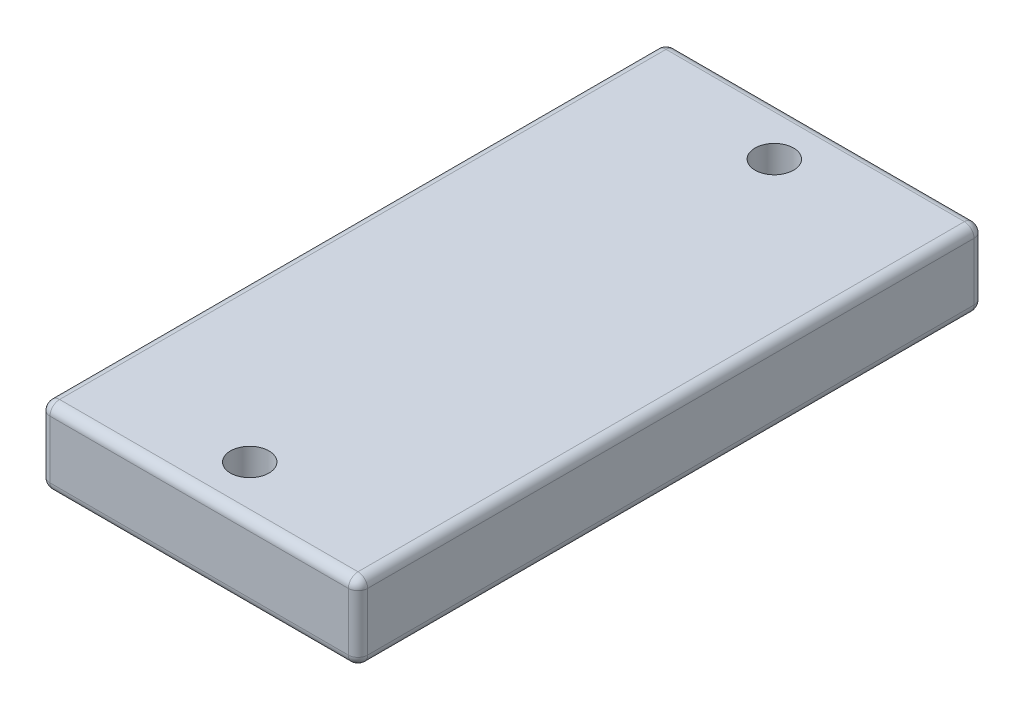
from build123d import *

# Parameters (mm, degrees)
CROQUIS1_W              = 33
CROQUIS1_H              = 65
SALIENTE_EXTRUIR1_DEPTH = 8
REDONDEO1_R             = 1
CROQUIS2_R              = 2
CORTAR_EXTRUIR1_DEPTH   = 74.334848469


with BuildPart() as part:
    # Croquis1 → Saliente-Extruir1 (new body)
    with BuildSketch(Plane(origin=(0, 0, 0), x_dir=(1, 0, 0), z_dir=(0, 1, 0))):
        with Locations((16.5, 32.5)):
            Rectangle(CROQUIS1_W, CROQUIS1_H)
    extrude(amount=SALIENTE_EXTRUIR1_DEPTH)

    # Redondeo1
    redondeo1_edges = [part.edges().sort_by_distance(p)[0] for p in [
        (33, 8, -32.5),
        (16.5, 8, -65),
        (0, 8, -32.5),
        (16.5, 0, -65),
        (33, 0, -32.5),
        (16.5, 0, 0),
        (0, 0, -32.5),
        (16.5, 8, 0),
        (0, 4, -65),
        (33, 4, -65),
        (33, 4, 0),
        (0, 4, 0),
    ]]
    fillet(redondeo1_edges, radius=REDONDEO1_R)

    # Croquis2 → Cortar-Extruir1 (cut, through all)
    with BuildSketch(Plane(origin=(0, 8, 0), x_dir=(1, 0, 0), z_dir=(0, 1, 0))):
        with Locations(Location((16.5, 5.25, 0), (0, 0, 270))):
            Circle(CROQUIS2_R)
        with Locations(Location((16.5, 59.75, 0), (0, 0, 270))):
            Circle(CROQUIS2_R)
    extrude(amount=-CORTAR_EXTRUIR1_DEPTH, mode=Mode.SUBTRACT)


solid = part.part
